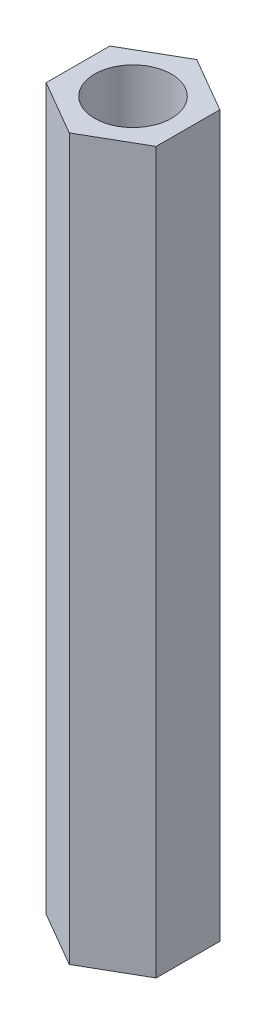
from build123d import *

# Parameters (mm, degrees)
BOSS_EXTRUDE1_DEPTH = 30
SKETCH2_R           = 1.6
CUT_EXTRUDE1_DEPTH  = 30


with BuildPart() as part:
    # Sketch1 → Boss-Extrude1 (new body)
    with BuildSketch(Plane(origin=(0, 0, 0), x_dir=(1, 0, 0), z_dir=(0, 1, 0))):
        Polygon((2.29220999, -1.329775836), (2.29772465, 1.320224164), (0.005514661, 2.65), (-2.29220999, 1.329775836), (-2.29772465, -1.320224164), (-0.005514661, -2.65), align=None)
    extrude(amount=BOSS_EXTRUDE1_DEPTH)

    # Sketch2 → Cut-Extrude1 (cut)
    with BuildSketch(Plane(origin=(0, 30, 0), x_dir=(1, 0, 0), z_dir=(0, 1, 0))):
        with Locations(Location((0, 0, 0), (0, 0, 270))):
            Circle(SKETCH2_R)
    extrude(amount=-CUT_EXTRUDE1_DEPTH, mode=Mode.SUBTRACT)


solid = part.part
